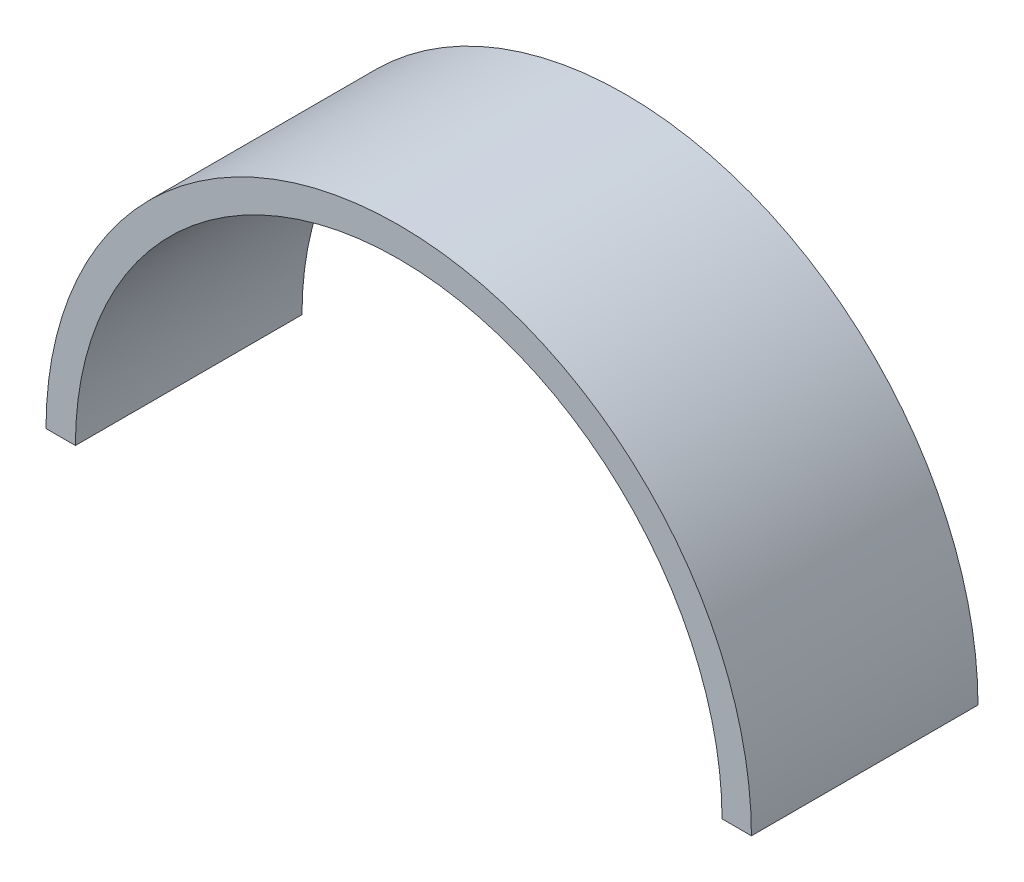
from build123d import *

# Parameters (mm, degrees)
SALIENTE_EXTRUIR1_DEPTH = 18.5


with BuildPart() as part:
    # Croquis1 → Saliente-Extruir1 (new body)
    with BuildSketch(Plane.XY):
        with BuildLine():
            Line((-26.4, 0), (-28.8, 0))
            ThreePointArc((-28.8, 0), (0, 28.8), (28.8, 0))
            Line((28.8, 0), (26.4, 0))
            ThreePointArc((26.4, 0), (0, 26.4), (-26.4, 0))
        make_face()
    extrude(amount=SALIENTE_EXTRUIR1_DEPTH)


solid = part.part
